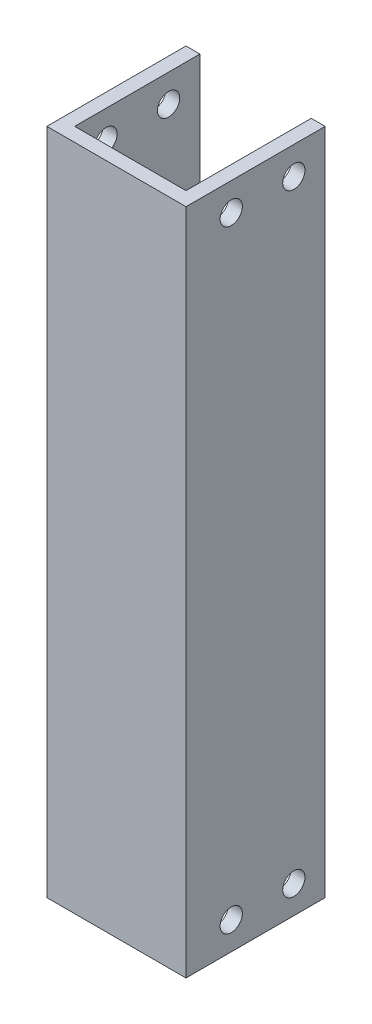
from build123d import *

# Parameters (mm, degrees)
BOSS_EXTRUDE1_DEPTH = 152.4
SKETCH2_R           = 2.54
CUT_EXTRUDE2_DEPTH  = 31.75


with BuildPart() as part:
    # Sketch1 → Boss-Extrude1 (new body)
    with BuildSketch(Plane(origin=(0, 0, 0), x_dir=(1, 0, 0), z_dir=(0, 1, 0))):
        Polygon((0, 0), (31.75, 0), (31.75, 31.75), (28.575, 31.75), (28.575, 3.175), (3.175, 3.175), (3.175, 31.75), (0, 31.75), align=None)
    extrude(amount=BOSS_EXTRUDE1_DEPTH)

    # Sketch2 → Cut-Extrude2 (cut)
    with BuildSketch(Plane(origin=(31.75, 0, 0), x_dir=(0, 0, -1), z_dir=(1, 0, 0))):
        with Locations((24.60625, 6.35)):
            Circle(SKETCH2_R)
        with Locations((10.31875, 6.35)):
            Circle(SKETCH2_R)
        with Locations((24.60625, 146.05)):
            Circle(SKETCH2_R)
        with Locations((10.31875, 146.05)):
            Circle(SKETCH2_R)
    extrude(amount=-CUT_EXTRUDE2_DEPTH, mode=Mode.SUBTRACT)


solid = part.part
